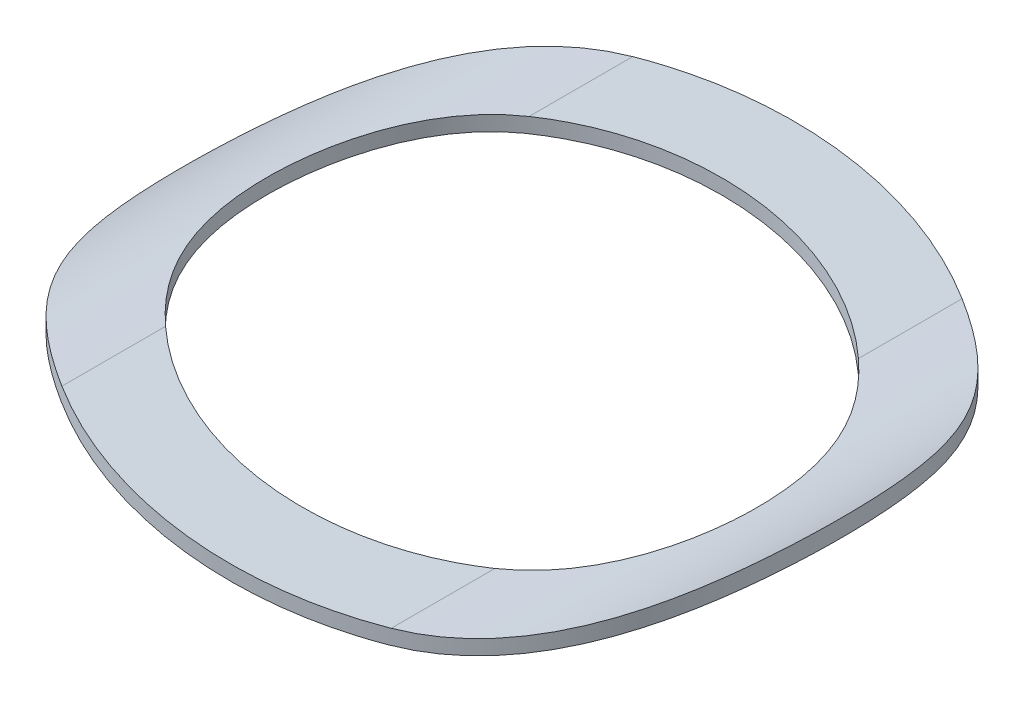
from build123d import *

# Parameters (mm, degrees)
EXTRUDE_THIN1_DEPTH = 15
SKETCH2_OUTSIDE_W   = 38.632
SKETCH2_OUTSIDE_H   = 40.272
SKETCH2_OUTSIDE_R   = 13.3
SKETCH2_OUTSIDE_R_2 = 9.9
EXTRUDE1_DEPTH      = 30


with BuildPart() as part:
    # Sketch1 → Extrude-Thin1 (new, symmetric)
    with BuildSketch(Plane.XY):
        with BuildLine():
            ThreePointArc((14, 0), (10.511476834, -1.679487802), (6.646471406, -1.907974583))
            Line((6.646471406, -1.907974583), (-6.646471406, -0.092025417))
            ThreePointArc((-6.646471406, -0.092025417), (-10.511476834, -0.320512198), (-14, -2))
            Line((-14, -2), (-13.64, -2.48))
            ThreePointArc((-13.64, -2.48), (-10.360788224, -0.901281466), (-6.727683122, -0.686503892))
            Line((-6.727683122, -0.686503892), (6.565259691, -2.502453058))
            ThreePointArc((6.565259691, -2.502453058), (10.662165444, -2.26025707), (14.36, -0.48))
            Line((14.36, -0.48), (14, 0))
        make_face()
    extrude(amount=EXTRUDE_THIN1_DEPTH, both=True)

    # Sketch2 outside → Extrude1 (cut)
    # profile 1 of 2: a face of its own
    with BuildSketch(Plane(origin=(0, 0, 0), x_dir=(1, 0, 0), z_dir=(0, 1, 0))):
        with Locations((0.18, 0)):
            Rectangle(SKETCH2_OUTSIDE_W, SKETCH2_OUTSIDE_H)
        with Locations(Location((0, 0, 0), (0, 0, 299.579355848))):
            Circle(SKETCH2_OUTSIDE_R, mode=Mode.SUBTRACT)
    # profile 2 of 2: a face of its own
    with BuildSketch(Plane(origin=(0, 0, 0), x_dir=(1, 0, 0), z_dir=(0, 1, 0))):
        with Locations(Location((0, 0, 0), (0, 0, 311.541132012))):
            Circle(SKETCH2_OUTSIDE_R_2)
    extrude(amount=-EXTRUDE1_DEPTH, mode=Mode.SUBTRACT)


solid = part.part
